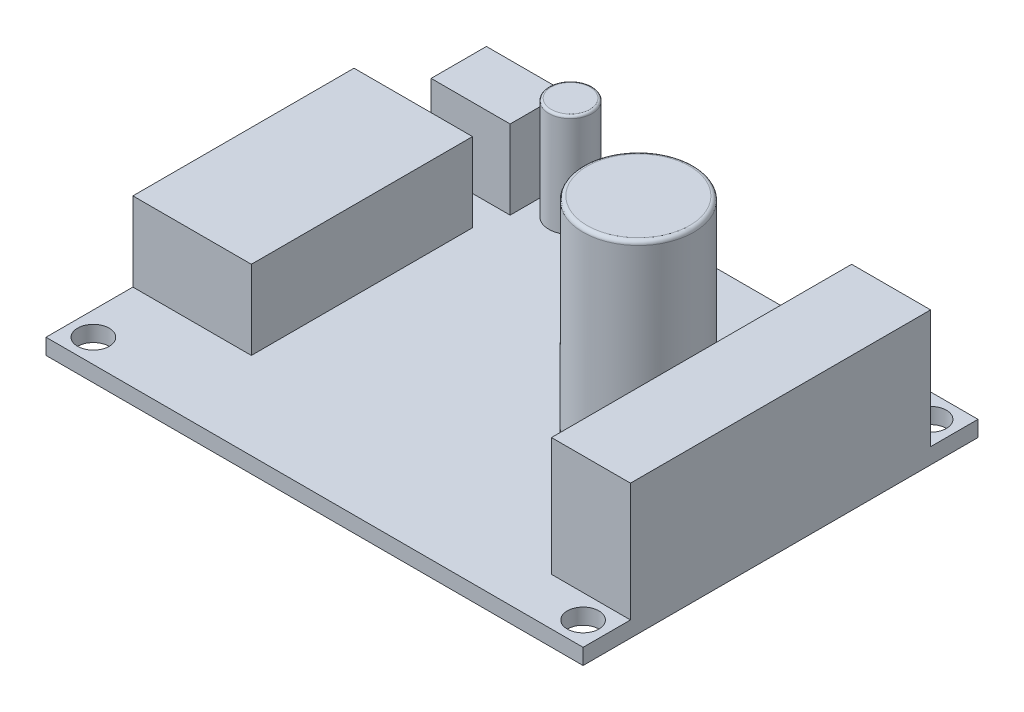
from build123d import *

# Parameters (mm, degrees)
SKETCH1_W           = 68
SKETCH1_H           = 50
SKETCH1_R           = 2
BOSS_EXTRUDE2_DEPTH = 2
SKETCH2_R           = 7
BOSS_EXTRUDE3_DEPTH = 28
FILLET1_R           = 0.5
SKETCH3_W           = 10
SKETCH3_H           = 38
BOSS_EXTRUDE4_DEPTH = 15
SKETCH4_W           = 15
SKETCH4_H           = 28
BOSS_EXTRUDE5_DEPTH = 10
SKETCH5_W           = 10
SKETCH5_H           = 7
BOSS_EXTRUDE6_DEPTH = 10
SKETCH6_R           = 2.75
BOSS_EXTRUDE7_DEPTH = 13
FILLET2_R           = 0.3


with BuildPart() as part:
    # Sketch1 → Boss-Extrude2 (new body)
    with BuildSketch(Plane(origin=(0, 0, 0), x_dir=(1, 0, 0), z_dir=(0, 1, 0))):
        Rectangle(SKETCH1_W, SKETCH1_H)
        with Locations(Location((-31, 22, 0), (0, 0, 270))):
            Circle(SKETCH1_R, mode=Mode.SUBTRACT)
        with Locations(Location((31, 22, 0), (0, 0, 90))):
            Circle(SKETCH1_R, mode=Mode.SUBTRACT)
        with Locations(Location((31, -22, 0), (0, 0, 270))):
            Circle(SKETCH1_R, mode=Mode.SUBTRACT)
        with Locations(Location((-31, -22, 0), (0, 0, 90))):
            Circle(SKETCH1_R, mode=Mode.SUBTRACT)
    extrude(amount=BOSS_EXTRUDE2_DEPTH)

    # Sketch2 → Boss-Extrude3 (add)
    with BuildSketch(Plane(origin=(0, 2, 0), x_dir=(1, 0, 0), z_dir=(0, 1, 0))):
        with Locations(Location((16, 0, 0), (0, 0, 90))):
            Circle(SKETCH2_R)
    extrude(amount=BOSS_EXTRUDE3_DEPTH)

    # Fillet1
    fillet1_edges = [part.edges().sort_by_distance(p)[0] for p in [
        (16, 30, 7),
    ]]
    fillet(fillet1_edges, radius=FILLET1_R)

    # Sketch3 → Boss-Extrude4 (add)
    with BuildSketch(Plane(origin=(0, 2, 0), x_dir=(1, 0, 0), z_dir=(0, 1, 0))):
        with Locations((29, 0)):
            Rectangle(SKETCH3_W, SKETCH3_H)
    extrude(amount=BOSS_EXTRUDE4_DEPTH)

    # Sketch4 → Boss-Extrude5 (add)
    with BuildSketch(Plane(origin=(0, 2, 0), x_dir=(1, 0, 0), z_dir=(0, 1, 0))):
        with Locations((-26.5, 0)):
            Rectangle(SKETCH4_W, SKETCH4_H)
    extrude(amount=BOSS_EXTRUDE5_DEPTH)

    # Sketch5 → Boss-Extrude6 (add)
    with BuildSketch(Plane(origin=(0, 2, 0), x_dir=(1, 0, 0), z_dir=(0, 1, 0))):
        with Locations((-23.001541076, 21.262939999)):
            Rectangle(SKETCH5_W, SKETCH5_H)
    extrude(amount=BOSS_EXTRUDE6_DEPTH)

    # Sketch6 → Boss-Extrude7 (add)
    with BuildSketch(Plane(origin=(0, 2, 0), x_dir=(1, 0, 0), z_dir=(0, 1, 0))):
        with Locations(Location((-14, 21.411376653, 0), (0, 0, 90))):
            Circle(SKETCH6_R)
    extrude(amount=BOSS_EXTRUDE7_DEPTH)

    # Fillet2
    fillet2_edges = [part.edges().sort_by_distance(p)[0] for p in [
        (-14, 15, -18.661376653),
    ]]
    fillet(fillet2_edges, radius=FILLET2_R)


solid = part.part
